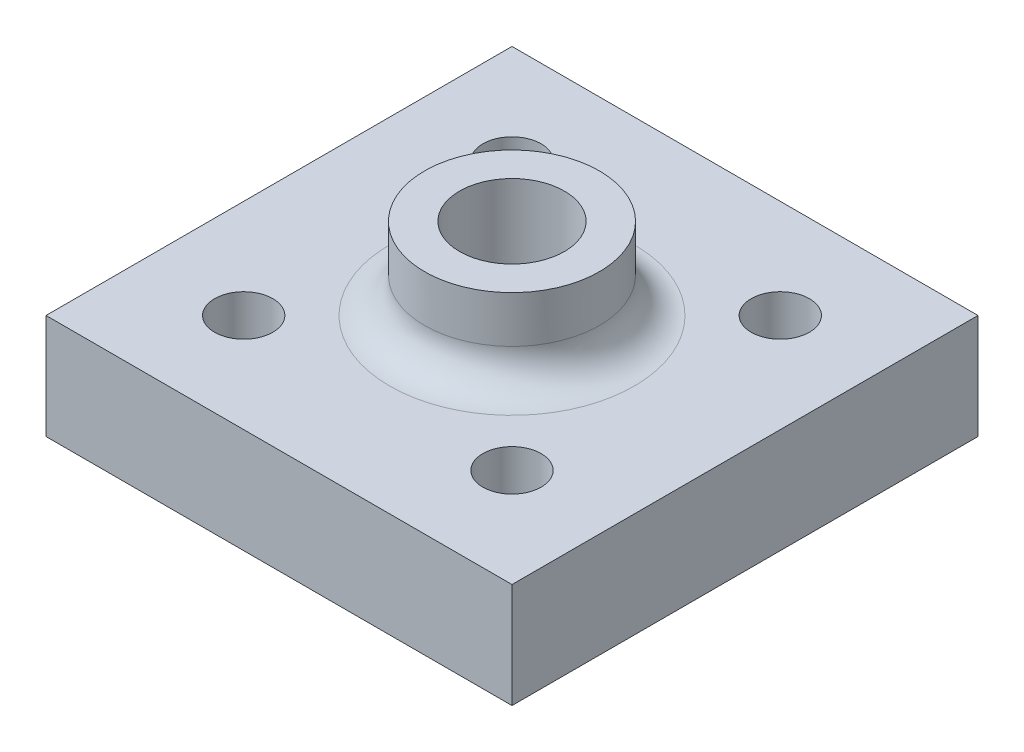
from build123d import *

# Parameters (mm, degrees)
SKETCH1_W           = 40
SKETCH1_H           = 40
BOSS_EXTRUDE1_DEPTH = 6
SKETCH2_W           = 40
SKETCH2_H           = 40
SKETCH2_R           = 4.5
BOSS_EXTRUDE2_DEPTH = 3
SKETCH3_R           = 2.5
CUT_EXTRUDE1_DEPTH  = 24
SKETCH4_R           = 7.5
SKETCH4_R_2         = 4.5
BOSS_EXTRUDE3_DEPTH = 7
FILLET1_R           = 3


with BuildPart() as part:
    # Sketch1 → Boss-Extrude1 (new body)
    with BuildSketch(Plane(origin=(0, 0, 0), x_dir=(1, 0, 0), z_dir=(0, 1, 0))):
        Rectangle(SKETCH1_W, SKETCH1_H)
        Polygon((7.505553499, 0), (3.75277675, 6.5), (-3.75277675, 6.5), (-7.505553499, 0), (-3.75277675, -6.5), (3.75277675, -6.5), align=None, mode=Mode.SUBTRACT)
    extrude(amount=BOSS_EXTRUDE1_DEPTH)

    # Sketch2 → Boss-Extrude2 (add)
    with BuildSketch(Plane(origin=(0, 6, 0), x_dir=(1, 0, 0), z_dir=(0, 1, 0))):
        Rectangle(SKETCH2_W, SKETCH2_H)
        with Locations(Location((0, 0, 0), (0, 0, 270))):
            Circle(SKETCH2_R, mode=Mode.SUBTRACT)
    extrude(amount=BOSS_EXTRUDE2_DEPTH)

    # Sketch3 → Cut-Extrude1 (cut)
    with BuildSketch(Plane(origin=(0, 9, 0), x_dir=(1, 0, 0), z_dir=(0, 1, 0))):
        with Locations(Location((-11.514718626, 11.514718626, 0), (0, 0, 270))):
            Circle(SKETCH3_R)
        with Locations(Location((11.514718626, 11.514718626, 0), (0, 0, 270))):
            Circle(SKETCH3_R)
        with Locations(Location((11.514718626, -11.514718626, 0), (0, 0, 270))):
            Circle(SKETCH3_R)
        with Locations(Location((-11.514718626, -11.514718626, 0), (0, 0, 270))):
            Circle(SKETCH3_R)
    extrude(amount=-CUT_EXTRUDE1_DEPTH, mode=Mode.SUBTRACT)

    # Sketch4 → Boss-Extrude3 (add)
    with BuildSketch(Plane(origin=(0, 9, 0), x_dir=(1, 0, 0), z_dir=(0, 1, 0))):
        with Locations(Location((0, 0, 0), (0, 0, 90))):
            Circle(SKETCH4_R)
        with Locations(Location((0, 0, 0), (0, 0, 270))):
            Circle(SKETCH4_R_2, mode=Mode.SUBTRACT)
    extrude(amount=BOSS_EXTRUDE3_DEPTH)

    # Fillet1
    fillet1_edges = [part.edges().sort_by_distance(p)[0] for p in [
        (0, 9, 7.5),
    ]]
    fillet(fillet1_edges, radius=FILLET1_R)


solid = part.part
